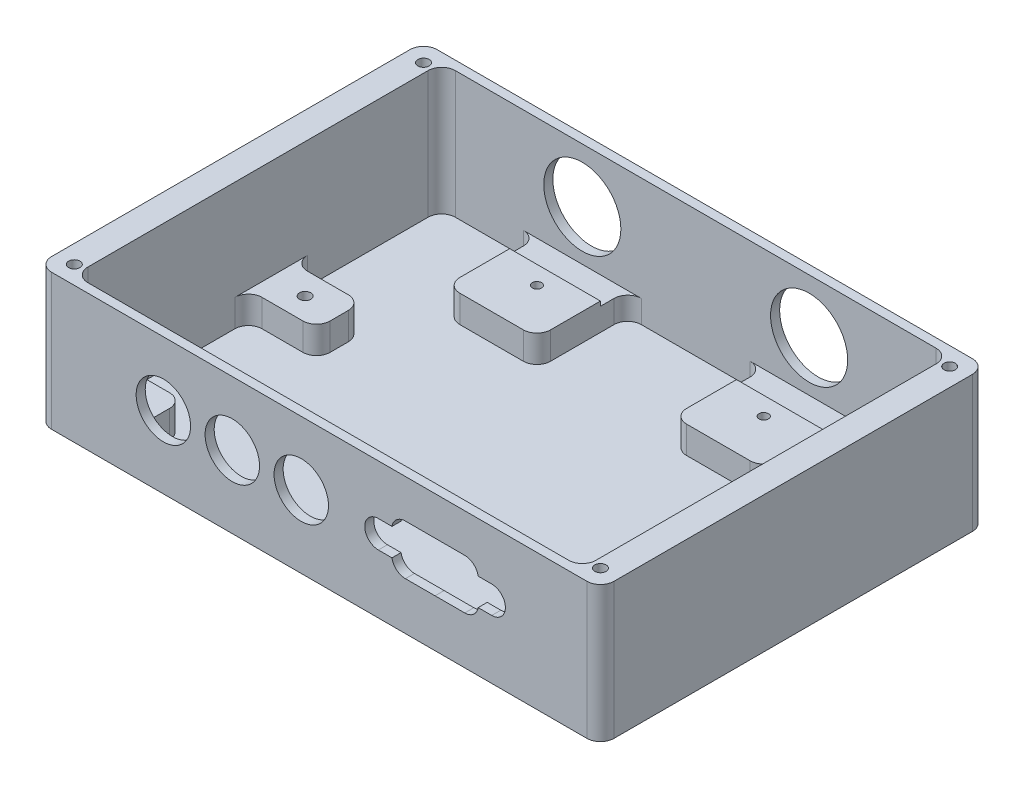
from build123d import *

# Parameters (mm, degrees)
SKIZZE1_W                       = 116
SKIZZE1_H                       = 85
AUFSATZ_LINEAR_AUSTRAGEN1_DEPTH = 30
SCHALE1_T                       = -2
SKIZZE2_R                       = 6
SCHNITT_LINEAR_AUSTRAGEN1_DEPTH = 30
SCHNITT_LINEAR_AUSTRAGEN2_DEPTH = 10
VERRUNDUNG1_R                   = 3
AUFSATZ_LINEAR_AUSTRAGEN2_DEPTH = 6
VERRUNDUNG2_R                   = 3
SKIZZE5_W                       = 15
SKIZZE5_H                       = 10
AUFSATZ_LINEAR_AUSTRAGEN3_DEPTH = 6
VERRUNDUNG3_R                   = 3
SKIZZE6_R                       = 8.5
SCHNITT_LINEAR_AUSTRAGEN3_DEPTH = 5
SKIZZE7_W                       = 20
SKIZZE7_H                       = 20
AUFSATZ_LINEAR_AUSTRAGEN4_DEPTH = 6
VERRUNDUNG4_R                   = 3
M3_GEWINDEBOHRUNG1_D            = 2.5
M3_GEWINDEBOHRUNG1_DEPTH        = 8.5
M3_GEWINDEBOHRUNG1_TIP          = 0.751075774
M2_5_GEWINDEBOHRUNG1_D          = 2.05
M2_5_GEWINDEBOHRUNG1_DEPTH      = 7.25
M2_5_GEWINDEBOHRUNG1_TIP        = 0.615882135
SKIZZE12_W                      = 90
SKIZZE12_H                      = 6
SCHNITT_LINEAR_AUSTRAGEN4_DEPTH = 1
SKIZZE13_R                      = 3.2
SCHNITT_LINEAR_AUSTRAGEN5_DEPTH = 10
AUFSATZ_LINEAR_START            = -30
AUFSATZ_LINEAR_AUSTRAGEN5_DEPTH = 30
VERRUNDUNG5_R                   = 3
M3_GEWINDEBOHRUNG2_D            = 2.5
M3_GEWINDEBOHRUNG2_DEPTH        = 8.5
M3_GEWINDEBOHRUNG2_TIP          = 0.751075774


with BuildPart() as part:
    # Skizze1 → Aufsatz-Linear austragen1 (new body)
    with BuildSketch(Plane(origin=(0, 0, 0), x_dir=(1, 0, 0), z_dir=(0, 1, 0))):
        with Locations((58, 42.5)):
            Rectangle(SKIZZE1_W, SKIZZE1_H)
    extrude(amount=AUFSATZ_LINEAR_AUSTRAGEN1_DEPTH)

    # Schale1
    schale1_openings = [part.faces().sort_by_distance(p)[0] for p in [
        (58, 30, -42.5),
    ]]
    offset(amount=SCHALE1_T, openings=schale1_openings, kind=Kind.INTERSECTION)

    # Skizze2 → Schnitt-Linear austragen1 (cut)
    with BuildSketch(Plane.XY):
        with Locations((23.64, 15.94)):
            Circle(SKIZZE2_R)
        with Locations((38.84, 15.94)):
            Circle(SKIZZE2_R)
        with Locations((54.04, 15.94)):
            Circle(SKIZZE2_R)
    extrude(amount=-SCHNITT_LINEAR_AUSTRAGEN1_DEPTH, mode=Mode.SUBTRACT)

    # Skizze3 → Schnitt-Linear austragen2 (cut)
    with BuildSketch(Plane.XY):
        with BuildLine():
            ThreePointArc((90.082181292, 21.48963825), (92.018633773, 20.780819017), (93.040082938, 18.989474685))
            Line((93.040082938, 18.989474685), (96.04016588, 18.989308791))
            ThreePointArc((96.04016588, 18.989308791), (99.039999986, 15.989142906), (96.039834101, 12.9893088))
            Line((96.039834101, 12.9893088), (93.03975116, 12.989474694))
            ThreePointArc((93.03975116, 12.989474694), (92.018103892, 11.198243337), (90.081573032, 10.489638266))
            Line((90.081573032, 10.489638266), (83.54015207, 10.49))
            Line((83.54015207, 10.49), (76.998122837, 10.49))
            ThreePointArc((76.998122837, 10.49), (75.061631164, 11.198712153), (74.040082946, 12.99))
            Line((74.040082946, 12.99), (71.04, 12.99))
            ThreePointArc((71.04, 12.99), (68.04, 15.99), (71.04, 18.99))
            Line((71.04, 18.99), (74.040082946, 18.99))
            ThreePointArc((74.040082946, 18.99), (75.061631164, 20.781287847), (76.998122837, 21.49))
            Line((76.998122837, 21.49), (83.54015207, 21.49))
            Line((83.54015207, 21.49), (90.082181292, 21.48963825))
        make_face()
    extrude(amount=-SCHNITT_LINEAR_AUSTRAGEN2_DEPTH, mode=Mode.SUBTRACT)

    # Verrundung1
    verrundung1_edges = [part.edges().sort_by_distance(p)[0] for p in [
        (2, 16, -83),
        (2, 16, -2),
        (114, 16, -2),
        (114, 16, -83),
        (0, 15, -85),
        (116, 15, -85),
        (116, 15, 0),
        (0, 15, 0),
    ]]
    fillet(verrundung1_edges, radius=VERRUNDUNG1_R)

    # Skizze4 → Aufsatz-Linear austragen2 (add)
    with BuildSketch(Plane(origin=(0, 2, 0), x_dir=(1, 0, 0), z_dir=(0, 1, 0))):
        with BuildLine():
            Line((13, 12), (2, 12))
            Line((2, 12), (2, 5))
            ThreePointArc((2, 5), (2.878679656, 2.878679656), (5, 2))
            Line((5, 2), (16, 2))
            Line((16, 2), (16, 9))
            ThreePointArc((16, 9), (15.121320344, 11.121320344), (13, 12))
        make_face()
        with BuildLine():
            Line((100, 9), (100, 2))
            Line((100, 2), (111, 2))
            ThreePointArc((111, 2), (113.121320344, 2.878679656), (114, 5))
            Line((114, 5), (114, 12))
            Line((114, 12), (103, 12))
            ThreePointArc((103, 12), (100.878679656, 11.121320344), (100, 9))
        make_face()
    extrude(amount=AUFSATZ_LINEAR_AUSTRAGEN2_DEPTH)

    # Verrundung2
    verrundung2_edges = [part.edges().sort_by_distance(p)[0] for p in [
        (2, 5, -12),
        (16, 5, -2),
        (114, 5, -12),
        (100, 5, -2),
    ]]
    fillet(verrundung2_edges, radius=VERRUNDUNG2_R)

    # Skizze5 → Aufsatz-Linear austragen3 (add)
    with BuildSketch(Plane(origin=(0, 2, 0), x_dir=(1, 0, 0), z_dir=(0, 1, 0))):
        with Locations((9.5, 45.4)):
            Rectangle(SKIZZE5_W, SKIZZE5_H)
        with Locations((106.5, 45.4)):
            Rectangle(SKIZZE5_W, SKIZZE5_H)
    extrude(amount=AUFSATZ_LINEAR_AUSTRAGEN3_DEPTH)

    # Verrundung3
    verrundung3_edges = [part.edges().sort_by_distance(p)[0] for p in [
        (2, 5, -50.4),
        (2, 5, -40.4),
        (17, 5, -40.4),
        (17, 5, -50.4),
        (114, 5, -50.4),
        (99, 5, -50.4),
        (99, 5, -40.4),
        (114, 5, -40.4),
    ]]
    fillet(verrundung3_edges, radius=VERRUNDUNG3_R)

    # Skizze6 → Schnitt-Linear austragen3 (cut)
    with BuildSketch(Plane(origin=(0, 0, -85), x_dir=(-1, 0, 0), z_dir=(0, 0, -1))):
        with Locations((-83, 18)):
            Circle(SKIZZE6_R)
        with Locations(Location((-33, 18, 0), (0, 0, 180))):
            Circle(SKIZZE6_R)
    extrude(amount=-SCHNITT_LINEAR_AUSTRAGEN3_DEPTH, mode=Mode.SUBTRACT)

    # Skizze7 → Aufsatz-Linear austragen4 (add)
    with BuildSketch(Plane(origin=(0, 2, 0), x_dir=(1, 0, 0), z_dir=(0, 1, 0))):
        with Locations((33, 73)):
            Rectangle(SKIZZE7_W, SKIZZE7_H)
        with Locations((83, 73)):
            Rectangle(SKIZZE7_W, SKIZZE7_H)
    extrude(amount=AUFSATZ_LINEAR_AUSTRAGEN4_DEPTH)

    # Verrundung4
    verrundung4_edges = [part.edges().sort_by_distance(p)[0] for p in [
        (23, 5, -63),
        (43, 5, -63),
        (43, 5, -83),
        (23, 5, -83),
        (73, 5, -63),
        (93, 5, -63),
        (93, 5, -83),
        (73, 5, -83),
    ]]
    fillet(verrundung4_edges, radius=VERRUNDUNG4_R)

    # M3 Gewindebohrung1
    with Locations(Plane(origin=(0, 8, 0), x_dir=(1, 0, 0), z_dir=(0, 1, 0))):
        with Locations((106.5, 7.4), (9.5, 45.4), (106.5, 45.4), (9.5, 7.4)):
            Hole(M3_GEWINDEBOHRUNG1_D / 2, depth=M3_GEWINDEBOHRUNG1_DEPTH)
            with Locations((0, 0, -(M3_GEWINDEBOHRUNG1_DEPTH + M3_GEWINDEBOHRUNG1_TIP / 2))):  # 118° drill point
                Cone(0, M3_GEWINDEBOHRUNG1_D / 2, M3_GEWINDEBOHRUNG1_TIP, mode=Mode.SUBTRACT)

    # M2.5 Gewindebohrung1
    with Locations(Plane(origin=(0, 8, 0), x_dir=(1, 0, 0), z_dir=(0, 1, 0))):
        with Locations((33, 73), (83, 73)):
            Hole(M2_5_GEWINDEBOHRUNG1_D / 2, depth=M2_5_GEWINDEBOHRUNG1_DEPTH)
            with Locations((0, 0, -(M2_5_GEWINDEBOHRUNG1_DEPTH + M2_5_GEWINDEBOHRUNG1_TIP / 2))):  # 118° drill point
                Cone(0, M2_5_GEWINDEBOHRUNG1_D / 2, M2_5_GEWINDEBOHRUNG1_TIP, mode=Mode.SUBTRACT)

    # Skizze12 → Schnitt-Linear austragen4 (cut)
    with BuildSketch(Plane(origin=(0, 8, 0), x_dir=(1, 0, 0), z_dir=(0, 1, 0))):
        with Locations((63.848936769, 80)):
            Rectangle(SKIZZE12_W, SKIZZE12_H)
    extrude(amount=-SCHNITT_LINEAR_AUSTRAGEN4_DEPTH, mode=Mode.SUBTRACT)

    # Skizze13 → Schnitt-Linear austragen5 (cut)
    with BuildSketch(Plane(origin=(0, 2, 0), x_dir=(1, 0, 0), z_dir=(0, 1, 0))):
        with Locations(Location((88, 25, 0), (0, 0, 270))):
            Circle(SKIZZE13_R)
        with Locations(Location((28, 25, 0), (0, 0, 90))):
            Circle(SKIZZE13_R)
    extrude(amount=-SCHNITT_LINEAR_AUSTRAGEN5_DEPTH, mode=Mode.SUBTRACT)

    # Skizze14 → Aufsatz-Linear austragen5 (add)
    with BuildSketch(Plane(origin=(0, 0, 0), x_dir=(-1, 0, 0), z_dir=(0, -1, 0)).offset(AUFSATZ_LINEAR_START)):
        with BuildLine():
            Line((-116, 0), (-120, 0))
            Line((-120, 0), (-120, 85))
            Line((-120, 85), (-116, 85))
            Line((-116, 85), (-113, 85))
            ThreePointArc((-113, 85), (-115.121320344, 84.121320344), (-116, 82))
            Line((-116, 82), (-116, 3))
            ThreePointArc((-116, 3), (-115.121320344, 0.878679656), (-113, 0))
            Line((-113, 0), (-116, 0))
        make_face()
        with BuildLine():
            Line((0, 85), (4, 85))
            Line((4, 85), (4, 0))
            Line((4, 0), (0, 0))
            Line((0, 0), (-3, 0))
            ThreePointArc((-3, 0), (-0.878679656, 0.878679656), (0, 3))
            Line((0, 3), (0, 82))
            ThreePointArc((0, 82), (-0.878679656, 84.121320344), (-3, 85))
            Line((-3, 85), (0, 85))
        make_face()
    extrude(amount=AUFSATZ_LINEAR_AUSTRAGEN5_DEPTH)

    # Verrundung5
    verrundung5_edges = [part.edges().sort_by_distance(p)[0] for p in [
        (120, 15, 0),
        (120, 15, -85),
        (-4, 15, -85),
        (-4, 15, 0),
    ]]
    fillet(verrundung5_edges, radius=VERRUNDUNG5_R)

    # M3 Gewindebohrung2
    with Locations(Plane(origin=(0, 30, 0), x_dir=(1, 0, 0), z_dir=(0, 1, 0))):
        with Locations((0, 4), (116, 81), (0, 81), (116, 4)):
            Hole(M3_GEWINDEBOHRUNG2_D / 2, depth=M3_GEWINDEBOHRUNG2_DEPTH)
            with Locations((0, 0, -(M3_GEWINDEBOHRUNG2_DEPTH + M3_GEWINDEBOHRUNG2_TIP / 2))):  # 118° drill point
                Cone(0, M3_GEWINDEBOHRUNG2_D / 2, M3_GEWINDEBOHRUNG2_TIP, mode=Mode.SUBTRACT)


solid = part.part
